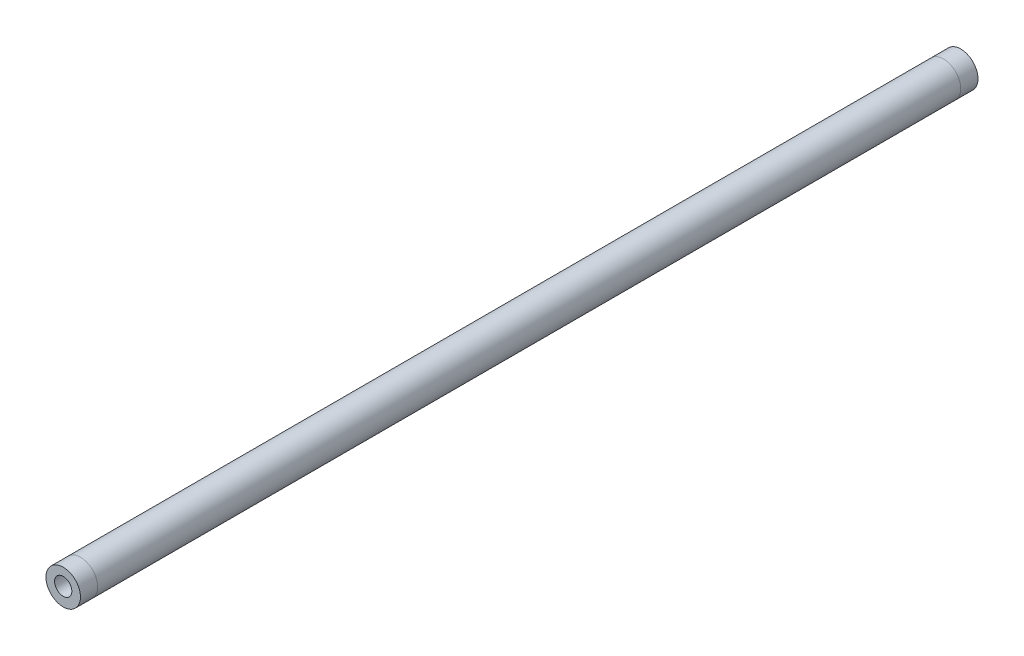
from build123d import *

# Parameters (mm, degrees)
THREADED_START            = -21.8948
SKETCH2_R                 = 6.35
SKETCH2_R_2               = 4.7625
SKETCH2_R_3               = 3.175
THREADED_INSERT_1_1_DEPTH = 6.35
THREADED_START_2          = -28.2448
SKETCH2_5_R               = 4.7625
SKETCH2_5_R_2             = 3.175
THREADED_INSERT_1_2_DEPTH = 9.525
BOSS_EXTRUDE4_START       = -352.287312
SKETCH2_7_R               = 6.35
SKETCH2_7_R_2             = 4.7625
SKETCH2_7_R_3             = 3.175
BOSS_EXTRUDE4_DEPTH       = 6.35
BOSS_EXTRUDE5_START       = -336.412312
SKETCH2_8_R               = 4.7625
SKETCH2_8_R_2             = 3.175
BOSS_EXTRUDE5_DEPTH       = 9.525
BOSS_EXTRUDE6_START       = -28.2448
SKETCH2_9_R               = 6.35
SKETCH2_9_R_2             = 4.7625
BOSS_EXTRUDE6_DEPTH       = 317.692511614


with BuildPart() as part:
    # Sketch2 → Threaded Insert 1-1 (new body)
    # profile 1 of 2: a face of its own
    with BuildSketch(Plane.XY.offset(THREADED_START)):
        Circle(SKETCH2_R)
        Circle(SKETCH2_R_2, mode=Mode.SUBTRACT)
    # profile 2 of 2: a face of its own
    with BuildSketch(Plane.XY.offset(THREADED_START)):
        Circle(SKETCH2_R_2)
        with Locations((0, 0.235008439)):
            Circle(SKETCH2_R_3, mode=Mode.SUBTRACT)
    extrude(amount=-THREADED_INSERT_1_1_DEPTH)

    # Sketch2<5> → Threaded Insert 1-2 (add)
    with BuildSketch(Plane.XY.offset(THREADED_START_2)):
        Circle(SKETCH2_5_R)
        with Locations((0, 0.235008439)):
            Circle(SKETCH2_5_R_2, mode=Mode.SUBTRACT)
    extrude(amount=-THREADED_INSERT_1_2_DEPTH)


with BuildPart() as body_2:
    # Sketch2<7> → Boss-Extrude4 (new body)
    # profile 1 of 2: a face of its own
    with BuildSketch(Plane.XY.offset(BOSS_EXTRUDE4_START)):
        Circle(SKETCH2_7_R)
        Circle(SKETCH2_7_R_2, mode=Mode.SUBTRACT)
    # profile 2 of 2: a face of its own
    with BuildSketch(Plane.XY.offset(BOSS_EXTRUDE4_START)):
        Circle(SKETCH2_7_R_2)
        with Locations((0, 0.235008439)):
            Circle(SKETCH2_7_R_3, mode=Mode.SUBTRACT)
    extrude(amount=BOSS_EXTRUDE4_DEPTH)

    # Sketch2<8> → Boss-Extrude5 (add)
    with BuildSketch(Plane.XY.offset(BOSS_EXTRUDE5_START)):
        with Locations(Location((0, 0, 0), (0, 0, 180))):
            Circle(SKETCH2_8_R)
        with Locations((0, 0.235008439)):
            Circle(SKETCH2_8_R_2, mode=Mode.SUBTRACT)
    extrude(amount=-BOSS_EXTRUDE5_DEPTH)


with BuildPart() as body_3:
    # Sketch2<9> → Boss-Extrude6 (new body)
    with BuildSketch(Plane.XY.offset(BOSS_EXTRUDE6_START)):
        Circle(SKETCH2_9_R)
        Circle(SKETCH2_9_R_2, mode=Mode.SUBTRACT)
    extrude(amount=-BOSS_EXTRUDE6_DEPTH)


solid = Compound([part.part, body_2.part, body_3.part])
